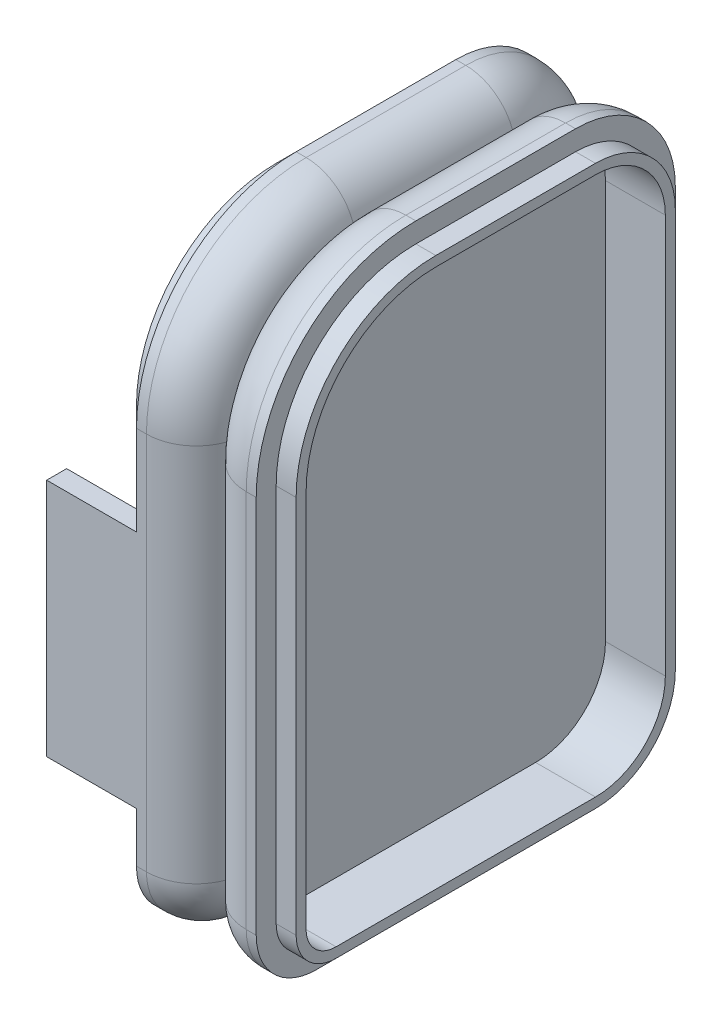
from build123d import *

# Parameters (mm, degrees)
SKETCH_1_W           = 1
SKETCH_1_H           = 1.9
SKETCH_1_W_2         = 2
SKETCH_1_H_2         = 60
EXTRUDE_1_DEPTH      = 90
SKETCH_2_W           = 2
SKETCH_2_H           = 24
CUT_EXTRUDE_1_DEPTH  = 117.034477635
SKETCH_4_W           = 1
SKETCH_4_H           = 0.1
EXTRUDE_2_DEPTH      = 3
SKETCH_5_W           = 2
SKETCH_5_H           = 24
EXTRUDE_3_DEPTH      = 10
SKETCH_6_W           = 42
SKETCH_6_H           = 60
EXTRUDE_4_DEPTH      = 2
EXTRUDE_5_REACH      = 122.702
SKETCH_8_W           = 10
SKETCH_8_H           = 2
FILLET_1_R           = 14
FILLET_2_R           = 16
FILLET_4_R           = 8
FILLET_5_R           = 10
FILLET_6_R           = 4
FILLET_7_R           = 6
FILLET_8_R           = 5
FILLET_9_R           = 1
CUT_EXTRUDE_START    = -80
CUT_EXTRUDE_2_DEPTH  = 80
CUT_EXTRUDE_3_DEPTH  = 16
EXTRUDE_7_DEPTH      = 2
EXTRUDE_7_DEPTH_BACK = 4
SKETCH_13_W          = 2
SKETCH_13_H          = 24
EXTRUDE_8_DEPTH      = 9
SKETCH_14_W          = 1.5
SKETCH_14_H          = 5
CUT_EXTRUDE_4_DEPTH  = 75.384138151
SKETCH_15_R          = 1.5
CUT_EXTRUDE_5_DEPTH  = 75.759614822


with BuildPart() as part:
    # Эскиз1 → Бобышка-Вытянуть1 (new body)
    with BuildSketch(Plane(origin=(0, 0, 0), x_dir=(0, 0, -1), z_dir=(1, 0, 0))):
        Polygon((18, 60), (2, 60), (2, 58), (18, 58), (18, 58.1), align=None)
        with Locations((18.5, 59.05)):
            Rectangle(SKETCH_1_W, SKETCH_1_H)
        Polygon((40, 60), (19, 60), (19, 58.1), (19, 58), (40, 58), align=None)
        with Locations((1, 30)):
            Rectangle(SKETCH_1_W_2, SKETCH_1_H_2)
        Polygon((40, 2), (40, 0), (42, 0), (42, 60), (40, 60), (40, 58), align=None)
        Polygon((19, 1.9), (19, 0), (40, 0), (40, 2), (19, 2), align=None)
        with Locations((18.5, 0.95)):
            Rectangle(SKETCH_1_W, SKETCH_1_H)
        Polygon((2, 2), (2, 0), (18, 0), (18, 1.9), (18, 2), align=None)
    extrude(amount=-EXTRUDE_1_DEPTH)

    # Эскиз2 → Вырез-Вытянуть1 (cut, through all)
    with BuildSketch(Plane(origin=(0, 0, 0), x_dir=(0, 0, -1), z_dir=(1, 0, 0))):
        with Locations((1, 23)):
            Rectangle(SKETCH_2_W, SKETCH_2_H)
    extrude(amount=-CUT_EXTRUDE_1_DEPTH, mode=Mode.SUBTRACT)

    # Эскиз4 → Бобышка-Вытянуть2 (add)
    with BuildSketch(Plane.ZY.offset(90)):
        with Locations((-18.5, 58.05)):
            Rectangle(SKETCH_4_W, SKETCH_4_H)
        with Locations((-18.5, 1.95)):
            Rectangle(SKETCH_4_W, SKETCH_4_H)
    extrude(amount=-EXTRUDE_2_DEPTH)

    # Эскиз5 → Бобышка-Вытянуть3 (add)
    with BuildSketch(Plane.ZY.offset(90)):
        Polygon((0, 11), (-2, 11), (-2, 2), (-40, 2), (-40, 58), (-2, 58), (-2, 35), (0, 35), (0, 60), (-42, 60), (-42, 0), (0, 0), align=None)
        with Locations((-1, 23)):
            Rectangle(SKETCH_5_W, SKETCH_5_H)
    extrude(amount=EXTRUDE_3_DEPTH)

    # Эскиз6 → Бобышка-Вытянуть4 (add)
    with BuildSketch(Plane.ZY.offset(100)):
        with Locations((-21, 30)):
            Rectangle(SKETCH_6_W, SKETCH_6_H)
    extrude(amount=EXTRUDE_4_DEPTH)

    # Эскиз8 → Бобышка-Вытянуть5 (add, up to next)
    with BuildSketch(Plane(origin=(0, 11, 0), x_dir=(1, 0, 0), z_dir=(0, 1, 0)), mode=Mode.PRIVATE) as extrude_5_sk1:
        with Locations((-85, 1)):
            Rectangle(SKETCH_8_W, SKETCH_8_H)
    extrude_5_tool1 = extrude(extrude_5_sk1.sketch, amount=EXTRUDE_5_REACH, mode=Mode.PRIVATE) - part.part
    add(extrude_5_tool1.solids().sort_by_distance((-85, 11, -1))[0])

    # Скругление1
    fillet_1_edges = [part.edges().sort_by_distance(p)[0] for p in [
        (-50, 58, -2),
    ]]
    fillet(fillet_1_edges, radius=FILLET_1_R)

    # Скругление2
    fillet_2_edges = [part.edges().sort_by_distance(p)[0] for p in [
        (-51, 60, 0),
    ]]
    fillet(fillet_2_edges, radius=FILLET_2_R)

    # Скругление4
    fillet_4_edges = [part.edges().sort_by_distance(p)[0] for p in [
        (-50, 2, -40),
        (-50, 58, -40),
    ]]
    fillet(fillet_4_edges, radius=FILLET_4_R)

    # Скругление5
    fillet_5_edges = [part.edges().sort_by_distance(p)[0] for p in [
        (-51, 60, -42),
        (-51, 0, -42),
    ]]
    fillet(fillet_5_edges, radius=FILLET_5_R)

    # Скругление6
    fillet_6_edges = [part.edges().sort_by_distance(p)[0] for p in [
        (-50, 2, -2),
    ]]
    fillet(fillet_6_edges, radius=FILLET_6_R)

    # Скругление7
    fillet_7_edges = [part.edges().sort_by_distance(p)[0] for p in [
        (-51, 0, 0),
    ]]
    fillet(fillet_7_edges, radius=FILLET_7_R)

    # Скругление8
    fillet_8_edges = [part.edges().sort_by_distance(p)[0] for p in [
        (-102, 60, -24),
        (-102, 55.313708499, -4.686291501),
        (-102, 0, -19),
        (-102, 30, -42),
        (-102, 57.071067812, -39.071067812),
        (-102, 2.928932188, -39.071067812),
        (-102, 25, 0),
        (-102, 1.757359313, -1.757359313),
    ]]
    fillet(fillet_8_edges, radius=FILLET_8_R)

    # Скругление9
    fillet_9_edges = [part.edges().sort_by_distance(p)[0] for p in [
        (-100, 25, -2),
        (-100, 53.899494937, -6.100505063),
        (-100, 30, -40),
        (-100, 58, -24),
        (-100, 55.656854249, -37.656854249),
        (-100, 4.343145751, -37.656854249),
        (-100, 2, -19),
        (-100, 3.171572875, -3.171572875),
    ]]
    fillet(fillet_9_edges, radius=FILLET_9_R)

    # Эскиз9 → Вырез-Вытянуть2 (cut)
    with BuildSketch(Plane(origin=(0, 0, 0), x_dir=(0, 0, -1), z_dir=(1, 0, 0)).offset(CUT_EXTRUDE_START)):
        with BuildLine():
            Line((0, 11), (0, 6))
            ThreePointArc((0, 6), (1.757359313, 1.757359313), (6, 0))
            Line((6, 0), (32, 0))
            ThreePointArc((32, 0), (39.071067812, 2.928932188), (42, 10))
            Line((42, 10), (42, 50))
            ThreePointArc((42, 50), (39.071067812, 57.071067812), (32, 60))
            Line((32, 60), (16, 60))
            ThreePointArc((16, 60), (4.686291501, 55.313708499), (0, 44))
            Line((0, 44), (0, 35))
            Line((0, 35), (2, 35))
            Line((2, 35), (2, 44))
            ThreePointArc((2, 44), (6.100505063, 53.899494937), (16, 58))
            Line((16, 58), (18, 58))
            Line((18, 58), (18, 58.1))
            Line((18, 58.1), (19, 58.1))
            Line((19, 58.1), (19, 58))
            Line((19, 58), (32, 58))
            ThreePointArc((32, 58), (37.656854249, 55.656854249), (40, 50))
            Line((40, 50), (40, 10))
            ThreePointArc((40, 10), (37.656854249, 4.343145751), (32, 2))
            Line((32, 2), (19, 2))
            Line((19, 2), (19, 1.9))
            Line((19, 1.9), (18, 1.9))
            Line((18, 1.9), (18, 2))
            Line((18, 2), (6, 2))
            ThreePointArc((6, 2), (3.171572875, 3.171572875), (2, 6))
            Line((2, 6), (2, 11))
            Line((2, 11), (0, 11))
        make_face()
    extrude(amount=CUT_EXTRUDE_2_DEPTH, mode=Mode.SUBTRACT)

    # Эскиз10 → Вырез-Вытянуть3 (cut)
    with BuildSketch(Plane(origin=(-80, 0, 0), x_dir=(0, 0, -1), z_dir=(1, 0, 0))):
        with BuildLine():
            Line((0, 44), (0, 6))
            ThreePointArc((0, 6), (1.757359313, 1.757359313), (6, 0))
            Line((6, 0), (32, 0))
            ThreePointArc((32, 0), (39.071067812, 2.928932188), (42, 10))
            Line((42, 10), (42, 50))
            ThreePointArc((42, 50), (39.071067812, 57.071067812), (32, 60))
            Line((32, 60), (16, 60))
            ThreePointArc((16, 60), (4.686291501, 55.313708499), (0, 44))
        make_face()
    extrude(amount=-CUT_EXTRUDE_3_DEPTH, mode=Mode.SUBTRACT)

    # Эскиз12 → Бобышка-Вытянуть7 (add, two sides: drawn at the far end of the back side and taken through both)
    with BuildSketch(Plane(origin=(-96, 0, 0), x_dir=(0, 0, -1), z_dir=(1, 0, 0)).offset(-EXTRUDE_7_DEPTH_BACK)):
        with BuildLine():
            Line((2, 44), (2, 6))
            ThreePointArc((2, 6), (3.171572875, 3.171572875), (6, 2))
            Line((6, 2), (32, 2))
            ThreePointArc((32, 2), (37.656854249, 4.343145751), (40, 10))
            Line((40, 10), (40, 50))
            ThreePointArc((40, 50), (37.656854249, 55.656854249), (32, 58))
            Line((32, 58), (16, 58))
            ThreePointArc((16, 58), (6.100505063, 53.899494937), (2, 44))
        make_face()
        with BuildLine():
            Line((3, 44), (3, 6))
            ThreePointArc((3, 6), (3.878679656, 3.878679656), (6, 3))
            Line((6, 3), (32, 3))
            ThreePointArc((32, 3), (36.949747468, 5.050252532), (39, 10))
            Line((39, 10), (39, 50))
            ThreePointArc((39, 50), (36.949747468, 54.949747468), (32, 57))
            Line((32, 57), (16, 57))
            ThreePointArc((16, 57), (6.807611845, 53.192388155), (3, 44))
        make_face(mode=Mode.SUBTRACT)
    extrude(amount=EXTRUDE_7_DEPTH + EXTRUDE_7_DEPTH_BACK)


with BuildPart() as body_2:
    # Зеркальное отражение1: mirrored copy
    add(part.part.mirror(Plane.ZY.offset(102)))

    # Эскиз13 → Бобышка-Вытянуть8 (add)
    with BuildSketch(Plane.ZY.offset(108)):
        with Locations((-1, 23)):
            Rectangle(SKETCH_13_W, SKETCH_13_H)
    extrude(amount=EXTRUDE_8_DEPTH)

    # Эскиз14 → Вырез-Вытянуть4 (cut, through all)
    with BuildSketch(Plane.ZY.offset(104)):
        with Locations((-34.25, 42.5)):
            Rectangle(SKETCH_14_W, SKETCH_14_H)
    extrude(amount=-CUT_EXTRUDE_4_DEPTH, mode=Mode.SUBTRACT)

    # Эскиз15 → Вырез-Вытянуть5 (cut, through all)
    with BuildSketch(Plane(origin=(-102, 0, 0), x_dir=(0, 0, -1), z_dir=(1, 0, 0))):
        with Locations((10.4, 47)):
            Circle(SKETCH_15_R)
    extrude(amount=-CUT_EXTRUDE_5_DEPTH, mode=Mode.SUBTRACT)


solid = Compound([part.part, body_2.part])
